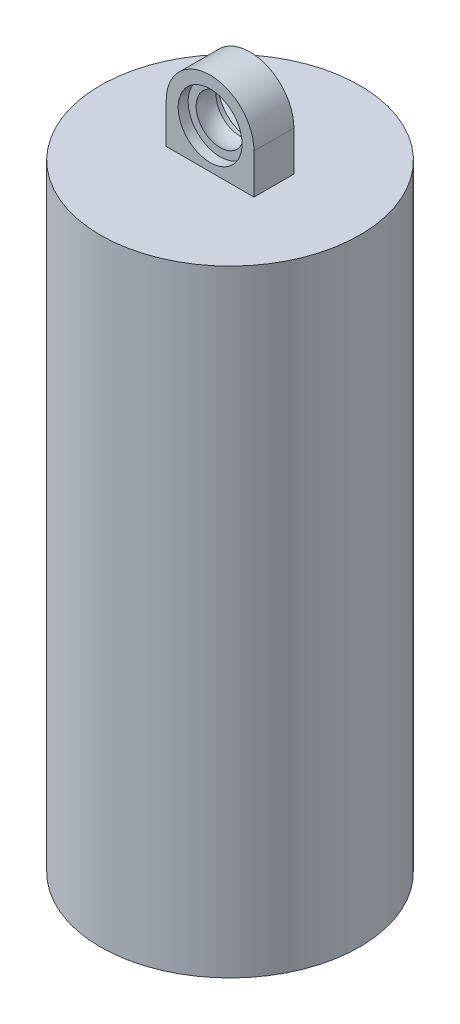
from build123d import *

# Parameters (mm, degrees)
SKETCH_1_R          = 32.5
EXTRUDE_1_DEPTH     = 154.5
SKETCH_2_R          = 12.5
EXTRUDE_2_DEPTH     = 6
SKETCH_3_R          = 6
CUT_EXTRUDE_1_DEPTH = 80
SKETCH_4_R          = 8
EXTRUDE_3_DEPTH     = 5
SKETCH_5_R          = 8
EXTRUDE_4_DEPTH     = 2.5
SKETCH_8_R          = 4
SKETCH_7_R          = 6
SKETCH_9_R          = 2.5
CUT_EXTRUDE_2_DEPTH = 31
SKETCH_10_R         = 6
CUT_EXTRUDE_3_DEPTH = 17


with BuildPart() as part:
    # 草图1 → 凸台-拉伸1 (new body)
    with BuildSketch(Plane(origin=(0, 0, 0), x_dir=(1, 0, 0), z_dir=(0, 1, 0))):
        with Locations(Location((0, 0, 0), (0, 0, 270))):
            Circle(SKETCH_1_R)
    extrude(amount=EXTRUDE_1_DEPTH)

    # 草图2 → 凸台-拉伸2 (add)
    with BuildSketch(Plane.XZ):
        with Locations(Location((0, 0, 0), (0, 0, 270))):
            Circle(SKETCH_2_R)
    extrude(amount=EXTRUDE_2_DEPTH)

    # 草图3 → 切除-拉伸1 (cut)
    with BuildSketch(Plane.XZ.offset(6)):
        with Locations(Location((0, 0, 0), (0, 0, 270))):
            Circle(SKETCH_3_R)
    extrude(amount=-CUT_EXTRUDE_1_DEPTH, mode=Mode.SUBTRACT)

    # 草图4 → 凸台-拉伸3 (add, symmetric)
    with BuildSketch(Plane.XY):
        with BuildLine():
            Line((-11, 154.5), (11, 154.5))
            Line((11, 154.5), (11, 164.5))
            ThreePointArc((11, 164.5), (0, 175.5), (-11, 164.5))
            Line((-11, 164.5), (-11, 154.5))
        make_face()
        with Locations((0, 164.5)):
            Circle(SKETCH_4_R, mode=Mode.SUBTRACT)
    extrude(amount=EXTRUDE_3_DEPTH, both=True)

    # 草图5 → 凸台-拉伸4 (add, symmetric)
    with BuildSketch(Plane.XY):
        with Locations((0, 164.5)):
            Circle(SKETCH_5_R)
    extrude(amount=EXTRUDE_4_DEPTH, both=True)

    # 草图8 → 放样1 section 0
    with BuildSketch(Plane.XY.offset(4.5)):
        with Locations((0, 164.5)):
            Circle(SKETCH_8_R)
    # 草图7 → 放样1 section 1
    with BuildSketch(Plane.XY.offset(2.5)):
        with Locations((0, 164.5)):
            Circle(SKETCH_7_R)
    loft_1 = loft()

    # 镜向1: 放样1 across plane
    add(loft_1.mirror(Plane.XY))

    # 草图9 → 切除-拉伸2 (cut)
    with BuildSketch(Plane.XY.offset(4.5)):
        with Locations((0, 166.761335751)):
            Circle(SKETCH_9_R)
    extrude(amount=-CUT_EXTRUDE_2_DEPTH, mode=Mode.SUBTRACT)

    # 草图10 → 切除-拉伸3 (cut)
    with BuildSketch(Plane.XY.offset(4.5)):
        with Locations((0, 164.5)):
            Circle(SKETCH_10_R)
    extrude(amount=-CUT_EXTRUDE_3_DEPTH, mode=Mode.SUBTRACT)

    # 草图11 → 切除-旋转1 (revolve, cut)
    with BuildSketch(Plane.XY):
        with BuildLine():
            Line((0, 171), (0, 158))
            ThreePointArc((0, 158), (6.5, 164.5), (0, 171))
        make_face()
    revolve(axis=Axis((0, 171, 0), (0, -1, 0)), mode=Mode.SUBTRACT)


solid = part.part
